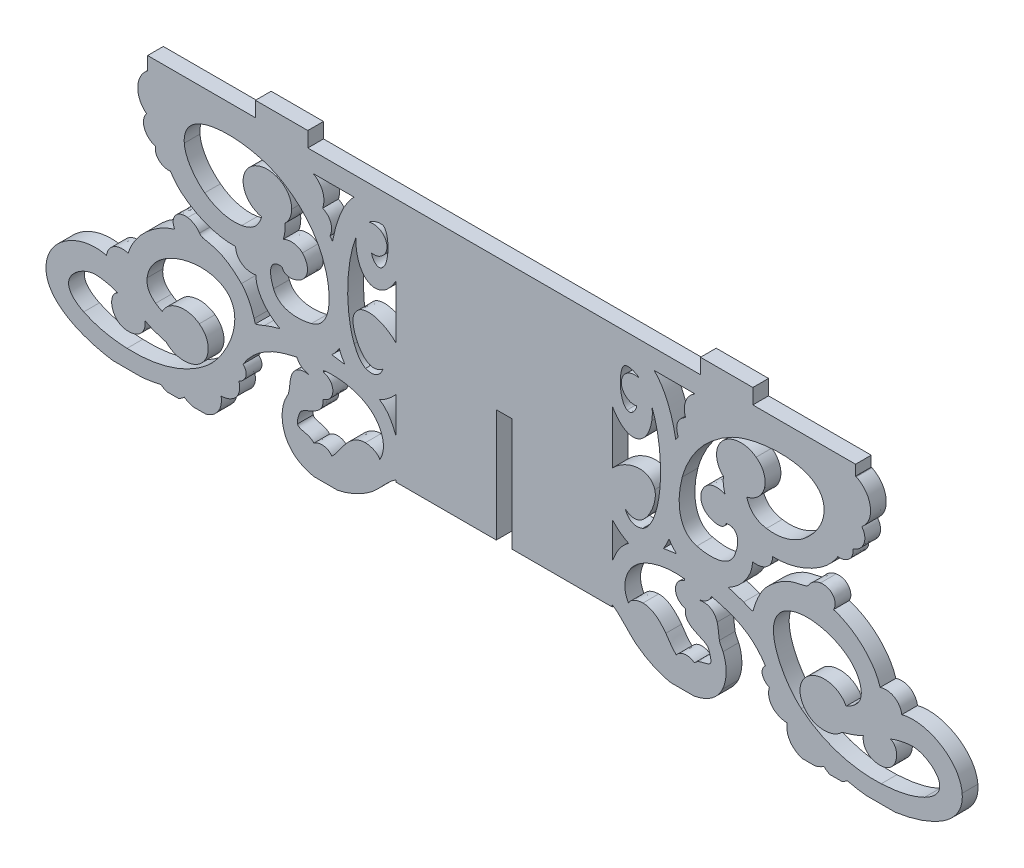
from build123d import *

# Parameters (mm, degrees)
RESSALTO_EXTRUS_O1_DEPTH = 2


with BuildPart() as part:
    # Model → Ressalto-extrusão1 (new body)
    with BuildSketch(Plane.XY):
        with BuildLine():
            Line((-5.6284, -71.1175), (-5.6464, -70.8746))
            add(Edge.make_bspline(
                [(-5.6464, -70.8746), (-6.5419, -71.3588), (-7.8893, -73.0536), (-8.6517, -73.6479)],
                knots=[0.00990099, 0.00990099, 0.00990099, 0.00990099, 0.01980198, 0.01980198, 0.01980198, 0.01980198], degree=3))
            add(Edge.make_bspline(
                [(-8.6517, -73.6479), (-9.9492, -74.6594), (-11.4791, -75.4122), (-13.1021, -75.7285)],
                knots=[0.01980198, 0.01980198, 0.01980198, 0.01980198, 0.02970297, 0.02970297, 0.02970297, 0.02970297], degree=3))
            Line((-13.1021, -75.7285), (-16.0542, -75.7291))
            add(Edge.make_bspline(
                [(-16.0542, -75.7291), (-17.6074, -75.4426), (-18.9753, -74.6493), (-19.6727, -73.1749)],
                knots=[0.03960396, 0.03960396, 0.03960396, 0.03960396, 0.04950495, 0.04950495, 0.04950495, 0.04950495], degree=3))
            add(Edge.make_bspline(
                [(-19.6727, -73.1749), (-20.2748, -71.9018), (-20.309, -70.2987), (-19.7445, -68.9995)],
                knots=[0.04950495, 0.04950495, 0.04950495, 0.04950495, 0.059405941, 0.059405941, 0.059405941, 0.059405941], degree=3))
            add(Edge.make_bspline(
                [(-19.7445, -68.9995), (-19.5924, -68.6493), (-19.3699, -68.3546), (-19.2888, -67.9672)],
                knots=[0.059405941, 0.059405941, 0.059405941, 0.059405941, 0.069306931, 0.069306931, 0.069306931, 0.069306931], degree=3))
            add(Edge.make_bspline(
                [(-19.2888, -67.9672), (-19.1614, -67.3578), (-19.1819, -66.7034), (-18.999, -66.1037)],
                knots=[0.069306931, 0.069306931, 0.069306931, 0.069306931, 0.079207921, 0.079207921, 0.079207921, 0.079207921], degree=3))
            add(Edge.make_bspline(
                [(-18.999, -66.1037), (-18.6689, -65.0219), (-17.8333, -64.6183), (-16.8102, -64.8106)],
                knots=[0.079207921, 0.079207921, 0.079207921, 0.079207921, 0.089108911, 0.089108911, 0.089108911, 0.089108911], degree=3))
            add(Edge.make_bspline(
                [(-16.8102, -64.8106), (-16.8066, -64.7918), (-16.8024, -64.7729), (-16.7979, -64.7539)],
                knots=[0.089108911, 0.089108911, 0.089108911, 0.089108911, 0.099009901, 0.099009901, 0.099009901, 0.099009901], degree=3))
            add(Edge.make_bspline(
                [(-16.7979, -64.7539), (-17.4996, -64.6554), (-17.9964, -64.2686), (-18.281, -63.636)],
                knots=[0.099009901, 0.099009901, 0.099009901, 0.099009901, 0.108910891, 0.108910891, 0.108910891, 0.108910891], degree=3))
            Line((-18.281, -63.636), (-19.6289, -63.9795))
            add(Edge.make_bspline(
                [(-19.6289, -63.9795), (-21.9055, -64.5921), (-23.8126, -65.7446), (-25.137, -67.8442)],
                knots=[0.118811881, 0.118811881, 0.118811881, 0.118811881, 0.128712871, 0.128712871, 0.128712871, 0.128712871], degree=3))
            add(Edge.make_bspline(
                [(-25.137, -67.8442), (-24.3471, -68.5533), (-24.768, -69.5566), (-25.6484, -69.984)],
                knots=[0.128712871, 0.128712871, 0.128712871, 0.128712871, 0.138613861, 0.138613861, 0.138613861, 0.138613861], degree=3))
            add(Edge.make_bspline(
                [(-25.6484, -69.984), (-25.2197, -71.4939), (-26.2828, -72.6736), (-27.9206, -72.7687)],
                knots=[0.138613861, 0.138613861, 0.138613861, 0.138613861, 0.148514851, 0.148514851, 0.148514851, 0.148514851], degree=3))
            add(Edge.make_bspline(
                [(-27.9206, -72.7687), (-27.6704, -74.1792), (-28.5691, -75.382), (-29.8849, -75.7243)],
                knots=[0.148514851, 0.148514851, 0.148514851, 0.148514851, 0.158415842, 0.158415842, 0.158415842, 0.158415842], degree=3))
            Line((-29.8849, -75.7243), (-31.4771, -75.7251))
            add(Edge.make_bspline(
                [(-31.4771, -75.7251), (-31.8723, -75.6269), (-32.2526, -75.4578), (-32.6065, -75.2243)],
                knots=[0.168316832, 0.168316832, 0.168316832, 0.168316832, 0.178217822, 0.178217822, 0.178217822, 0.178217822], degree=3))
            add(Edge.make_bspline(
                [(-32.6065, -75.2243), (-32.7813, -75.3936), (-33.1597, -75.6888), (-33.3867, -75.7342)],
                knots=[0.178217822, 0.178217822, 0.178217822, 0.178217822, 0.188118812, 0.188118812, 0.188118812, 0.188118812], degree=3))
            Line((-33.3867, -75.7342), (-34.8157, -75.7342))
            add(Edge.make_bspline(
                [(-34.8157, -75.7342), (-35.0116, -75.6974), (-35.4128, -75.4422), (-35.5882, -75.3144)],
                knots=[0.198019802, 0.198019802, 0.198019802, 0.198019802, 0.207920792, 0.207920792, 0.207920792, 0.207920792], degree=3))
            add(Edge.make_bspline(
                [(-35.5882, -75.3144), (-36.1338, -75.4582), (-37.442, -75.702), (-37.9546, -75.7342)],
                knots=[0.207920792, 0.207920792, 0.207920792, 0.207920792, 0.217821782, 0.217821782, 0.217821782, 0.217821782], degree=3))
            Line((-37.9546, -75.7342), (-41.6837, -75.7314))
            add(Edge.make_bspline(
                [(-41.6837, -75.7314), (-44.9016, -75.2916), (-50.559, -73.5038), (-50.1979, -69.3793)],
                knots=[0.227722772, 0.227722772, 0.227722772, 0.227722772, 0.237623762, 0.237623762, 0.237623762, 0.237623762], degree=3))
            add(Edge.make_bspline(
                [(-50.1979, -69.3793), (-49.9051, -66.0319), (-45.7279, -63.6924), (-42.5097, -64.5533)],
                knots=[0.237623762, 0.237623762, 0.237623762, 0.237623762, 0.247524752, 0.247524752, 0.247524752, 0.247524752], degree=3))
            add(Edge.make_bspline(
                [(-42.5097, -64.5533), (-42.3406, -63.309), (-41.1513, -62.4945), (-39.7553, -62.9251)],
                knots=[0.247524752, 0.247524752, 0.247524752, 0.247524752, 0.257425743, 0.257425743, 0.257425743, 0.257425743], degree=3))
            add(Edge.make_bspline(
                [(-39.7553, -62.9251), (-38.9652, -60.3066), (-36.3648, -58.0655), (-33.825, -57.3134)],
                knots=[0.257425743, 0.257425743, 0.257425743, 0.257425743, 0.267326733, 0.267326733, 0.267326733, 0.267326733], degree=3))
            add(Edge.make_bspline(
                [(-33.825, -57.3134), (-34.4145, -56.2855), (-33.6513, -54.9988), (-32.1639, -55.1959)],
                knots=[0.267326733, 0.267326733, 0.267326733, 0.267326733, 0.277227723, 0.277227723, 0.277227723, 0.277227723], degree=3))
            add(Edge.make_bspline(
                [(-32.1639, -55.1959), (-31.6489, -55.2641), (-30.977, -55.6469), (-30.6727, -56.1655)],
                knots=[0.277227723, 0.277227723, 0.277227723, 0.277227723, 0.287128713, 0.287128713, 0.287128713, 0.287128713], degree=3))
            add(Edge.make_bspline(
                [(-30.6727, -56.1655), (-30.2008, -56.97), (-28.3124, -56.0095), (-25.3267, -59.0606)],
                knots=[0.287128713, 0.287128713, 0.287128713, 0.287128713, 0.297029703, 0.297029703, 0.297029703, 0.297029703], degree=3))
            add(Edge.make_bspline(
                [(-25.3267, -59.0606), (-24.602, -59.801), (-24.0346, -61.0226), (-23.718, -62.0965)],
                knots=[0.297029703, 0.297029703, 0.297029703, 0.297029703, 0.306930693, 0.306930693, 0.306930693, 0.306930693], degree=3))
            add(Edge.make_bspline(
                [(-23.718, -62.0965), (-23.6918, -62.1858), (-23.611, -62.5128), (-23.5594, -62.6316)],
                knots=[0.306930693, 0.306930693, 0.306930693, 0.306930693, 0.316831683, 0.316831683, 0.316831683, 0.316831683], degree=3))
            add(Edge.make_bspline(
                [(-23.5594, -62.6316), (-23.2891, -62.5994), (-22.6447, -62.3095), (-22.3768, -62.2085)],
                knots=[0.316831683, 0.316831683, 0.316831683, 0.316831683, 0.326732673, 0.326732673, 0.326732673, 0.326732673], degree=3))
            add(Edge.make_bspline(
                [(-22.3768, -62.2085), (-21.7257, -61.9633), (-21.0761, -61.7478), (-20.4179, -61.5711)],
                knots=[0.326732673, 0.326732673, 0.326732673, 0.326732673, 0.336633663, 0.336633663, 0.336633663, 0.336633663], degree=3))
            add(Edge.make_bspline(
                [(-20.4179, -61.5711), (-22.012, -60.7087), (-23.4449, -59.0724), (-23.5064, -57.1855)],
                knots=[0.336633663, 0.336633663, 0.336633663, 0.336633663, 0.346534653, 0.346534653, 0.346534653, 0.346534653], degree=3))
            add(Edge.make_bspline(
                [(-23.5064, -57.1855), (-24.7892, -57.4359), (-26.0243, -56.7031), (-26.0724, -55.3434)],
                knots=[0.346534653, 0.346534653, 0.346534653, 0.346534653, 0.356435644, 0.356435644, 0.356435644, 0.356435644], degree=3))
            add(Edge.make_bspline(
                [(-26.0724, -55.3434), (-28.4957, -55.44), (-31.1466, -54.4236), (-32.9791, -52.8434)],
                knots=[0.356435644, 0.356435644, 0.356435644, 0.356435644, 0.366336634, 0.366336634, 0.366336634, 0.366336634], degree=3))
            add(Edge.make_bspline(
                [(-32.9791, -52.8434), (-33.492, -52.401), (-33.9776, -51.8123), (-34.3711, -51.1973)],
                knots=[0.366336634, 0.366336634, 0.366336634, 0.366336634, 0.376237624, 0.376237624, 0.376237624, 0.376237624], degree=3))
            add(Edge.make_bspline(
                [(-34.3711, -51.1973), (-35.3634, -51.3239), (-36.4953, -50.5348), (-36.2723, -49.4)],
                knots=[0.376237624, 0.376237624, 0.376237624, 0.376237624, 0.386138614, 0.386138614, 0.386138614, 0.386138614], degree=3))
            add(Edge.make_bspline(
                [(-36.2723, -49.4), (-37.635, -48.9585), (-38.2812, -47.4627), (-37.4127, -46.3692)],
                knots=[0.386138614, 0.386138614, 0.386138614, 0.386138614, 0.396039604, 0.396039604, 0.396039604, 0.396039604], degree=3))
            add(Edge.make_bspline(
                [(-37.4127, -46.3692), (-39.0338, -45.0675), (-38.818, -42.7399), (-37.2753, -41.5713)],
                knots=[0.396039604, 0.396039604, 0.396039604, 0.396039604, 0.405940594, 0.405940594, 0.405940594, 0.405940594], degree=3))
            Line((-37.2753, -41.5713), (-37.2753, -39.8829))
            Line((-37.2753, -39.8829), (-23.5478, -39.8829))
            Line((-23.5478, -39.8829), (-23.5478, -37.9569))
            Line((-23.5478, -37.9569), (-16.8811, -37.9569))
            Line((-16.8811, -37.9569), (-16.8811, -39.8829))
            add(Edge.make_bspline(
                [(-16.8811, -39.8829), (24.2554, -39.8829), (-8.0177, -39.8829), (33.1189, -39.8829)],
                knots=[0.455445545, 0.455445545, 0.455445545, 0.455445545, 0.465346535, 0.465346535, 0.465346535, 0.465346535], degree=3))
            Line((33.1189, -39.8829), (33.1189, -37.9569))
            Line((33.1189, -37.9569), (39.7856, -37.9569))
            Line((39.7856, -37.9569), (39.7856, -39.8829))
            Line((39.7856, -39.8829), (52.8602, -39.8829))
            Line((52.8602, -39.8829), (52.8602, -41.2009))
            Line((52.8602, -41.2009), (52.8959, -41.2009))
            Line((52.8959, -41.2009), (52.9623, -41.2332))
            add(Edge.make_bspline(
                [(52.9623, -41.2332), (54.9872, -42.2202), (55.4482, -44.9256), (53.6504, -46.3692)],
                knots=[0.534653465, 0.534653465, 0.534653465, 0.534653465, 0.544554455, 0.544554455, 0.544554455, 0.544554455], degree=3))
            add(Edge.make_bspline(
                [(53.6504, -46.3692), (54.519, -47.4627), (53.8727, -48.9585), (52.5101, -49.4)],
                knots=[0.544554455, 0.544554455, 0.544554455, 0.544554455, 0.554455446, 0.554455446, 0.554455446, 0.554455446], degree=3))
            add(Edge.make_bspline(
                [(52.5101, -49.4), (52.733, -50.5348), (51.6012, -51.3239), (50.6088, -51.1973)],
                knots=[0.554455446, 0.554455446, 0.554455446, 0.554455446, 0.564356436, 0.564356436, 0.564356436, 0.564356436], degree=3))
            add(Edge.make_bspline(
                [(50.6088, -51.1973), (50.2153, -51.8123), (49.7298, -52.401), (49.2168, -52.8434)],
                knots=[0.564356436, 0.564356436, 0.564356436, 0.564356436, 0.574257426, 0.574257426, 0.574257426, 0.574257426], degree=3))
            add(Edge.make_bspline(
                [(49.2168, -52.8434), (47.3843, -54.4236), (44.7334, -55.44), (42.3101, -55.3434)],
                knots=[0.574257426, 0.574257426, 0.574257426, 0.574257426, 0.584158416, 0.584158416, 0.584158416, 0.584158416], degree=3))
            add(Edge.make_bspline(
                [(42.3101, -55.3434), (42.262, -56.7031), (41.027, -57.4359), (39.7442, -57.1855)],
                knots=[0.584158416, 0.584158416, 0.584158416, 0.584158416, 0.594059406, 0.594059406, 0.594059406, 0.594059406], degree=3))
            add(Edge.make_bspline(
                [(39.7442, -57.1855), (39.6827, -59.0724), (38.2497, -60.7087), (36.6556, -61.5711)],
                knots=[0.594059406, 0.594059406, 0.594059406, 0.594059406, 0.603960396, 0.603960396, 0.603960396, 0.603960396], degree=3))
            add(Edge.make_bspline(
                [(36.6556, -61.5711), (37.3138, -61.7478), (37.9634, -61.9633), (38.6145, -62.2085)],
                knots=[0.603960396, 0.603960396, 0.603960396, 0.603960396, 0.613861386, 0.613861386, 0.613861386, 0.613861386], degree=3))
            add(Edge.make_bspline(
                [(38.6145, -62.2085), (38.8825, -62.3095), (39.5268, -62.5994), (39.7971, -62.6316)],
                knots=[0.613861386, 0.613861386, 0.613861386, 0.613861386, 0.623762376, 0.623762376, 0.623762376, 0.623762376], degree=3))
            add(Edge.make_bspline(
                [(39.7971, -62.6316), (39.8487, -62.5128), (39.9295, -62.1858), (39.9557, -62.0965)],
                knots=[0.623762376, 0.623762376, 0.623762376, 0.623762376, 0.633663366, 0.633663366, 0.633663366, 0.633663366], degree=3))
            add(Edge.make_bspline(
                [(39.9557, -62.0965), (40.2723, -61.0226), (40.8398, -59.801), (41.5644, -59.0606)],
                knots=[0.633663366, 0.633663366, 0.633663366, 0.633663366, 0.643564356, 0.643564356, 0.643564356, 0.643564356], degree=3))
            add(Edge.make_bspline(
                [(41.5644, -59.0606), (44.5501, -56.0095), (46.4385, -56.97), (46.9105, -56.1655)],
                knots=[0.643564356, 0.643564356, 0.643564356, 0.643564356, 0.653465347, 0.653465347, 0.653465347, 0.653465347], degree=3))
            add(Edge.make_bspline(
                [(46.9105, -56.1655), (47.2147, -55.6469), (47.8867, -55.2641), (48.4016, -55.1959)],
                knots=[0.653465347, 0.653465347, 0.653465347, 0.653465347, 0.663366337, 0.663366337, 0.663366337, 0.663366337], degree=3))
            add(Edge.make_bspline(
                [(48.4016, -55.1959), (49.8891, -54.9988), (50.6522, -56.2855), (50.0628, -57.3134)],
                knots=[0.663366337, 0.663366337, 0.663366337, 0.663366337, 0.673267327, 0.673267327, 0.673267327, 0.673267327], degree=3))
            add(Edge.make_bspline(
                [(50.0628, -57.3134), (52.6026, -58.0655), (55.2029, -60.3066), (55.9931, -62.9251)],
                knots=[0.673267327, 0.673267327, 0.673267327, 0.673267327, 0.683168317, 0.683168317, 0.683168317, 0.683168317], degree=3))
            add(Edge.make_bspline(
                [(55.9931, -62.9251), (57.389, -62.4945), (58.5783, -63.309), (58.7475, -64.5533)],
                knots=[0.683168317, 0.683168317, 0.683168317, 0.683168317, 0.693069307, 0.693069307, 0.693069307, 0.693069307], degree=3))
            add(Edge.make_bspline(
                [(58.7475, -64.5533), (61.9656, -63.6924), (66.1428, -66.0319), (66.4357, -69.3793)],
                knots=[0.693069307, 0.693069307, 0.693069307, 0.693069307, 0.702970297, 0.702970297, 0.702970297, 0.702970297], degree=3))
            add(Edge.make_bspline(
                [(66.4357, -69.3793), (66.7967, -73.5038), (61.1393, -75.2916), (57.9215, -75.7314)],
                knots=[0.702970297, 0.702970297, 0.702970297, 0.702970297, 0.712871287, 0.712871287, 0.712871287, 0.712871287], degree=3))
            Line((57.9215, -75.7314), (54.1924, -75.7342))
            add(Edge.make_bspline(
                [(54.1924, -75.7342), (53.6797, -75.702), (52.3716, -75.4582), (51.826, -75.3144)],
                knots=[0.722772277, 0.722772277, 0.722772277, 0.722772277, 0.732673267, 0.732673267, 0.732673267, 0.732673267], degree=3))
            add(Edge.make_bspline(
                [(51.826, -75.3144), (51.6505, -75.4422), (51.2493, -75.6974), (51.0535, -75.7342)],
                knots=[0.732673267, 0.732673267, 0.732673267, 0.732673267, 0.742574257, 0.742574257, 0.742574257, 0.742574257], degree=3))
            Line((51.0535, -75.7342), (49.6245, -75.7342))
            add(Edge.make_bspline(
                [(49.6245, -75.7342), (49.3974, -75.6888), (49.019, -75.3936), (48.8442, -75.2243)],
                knots=[0.752475248, 0.752475248, 0.752475248, 0.752475248, 0.762376238, 0.762376238, 0.762376238, 0.762376238], degree=3))
            add(Edge.make_bspline(
                [(48.8442, -75.2243), (48.4903, -75.4578), (48.11, -75.6269), (47.7148, -75.7251)],
                knots=[0.762376238, 0.762376238, 0.762376238, 0.762376238, 0.772277228, 0.772277228, 0.772277228, 0.772277228], degree=3))
            Line((47.7148, -75.7251), (46.1226, -75.7243))
            add(Edge.make_bspline(
                [(46.1226, -75.7243), (44.8069, -75.382), (43.9081, -74.1792), (44.1584, -72.7687)],
                knots=[0.782178218, 0.782178218, 0.782178218, 0.782178218, 0.792079208, 0.792079208, 0.792079208, 0.792079208], degree=3))
            add(Edge.make_bspline(
                [(44.1584, -72.7687), (42.5205, -72.6736), (41.4574, -71.4939), (41.8862, -69.984)],
                knots=[0.792079208, 0.792079208, 0.792079208, 0.792079208, 0.801980198, 0.801980198, 0.801980198, 0.801980198], degree=3))
            add(Edge.make_bspline(
                [(41.8862, -69.984), (41.0057, -69.5566), (40.5849, -68.5533), (41.3748, -67.8442)],
                knots=[0.801980198, 0.801980198, 0.801980198, 0.801980198, 0.811881188, 0.811881188, 0.811881188, 0.811881188], degree=3))
            add(Edge.make_bspline(
                [(41.3748, -67.8442), (40.0503, -65.7446), (38.1433, -64.5921), (35.8666, -63.9795)],
                knots=[0.811881188, 0.811881188, 0.811881188, 0.811881188, 0.821782178, 0.821782178, 0.821782178, 0.821782178], degree=3))
            Line((35.8666, -63.9795), (34.5187, -63.636))
            add(Edge.make_bspline(
                [(34.5187, -63.636), (34.2342, -64.2686), (33.7373, -64.6554), (33.0357, -64.7539)],
                knots=[0.831683168, 0.831683168, 0.831683168, 0.831683168, 0.841584158, 0.841584158, 0.841584158, 0.841584158], degree=3))
            add(Edge.make_bspline(
                [(33.0357, -64.7539), (33.0401, -64.7729), (33.0443, -64.7918), (33.048, -64.8106)],
                knots=[0.841584158, 0.841584158, 0.841584158, 0.841584158, 0.851485149, 0.851485149, 0.851485149, 0.851485149], degree=3))
            add(Edge.make_bspline(
                [(33.048, -64.8106), (34.071, -64.6183), (34.9066, -65.0219), (35.2367, -66.1037)],
                knots=[0.851485149, 0.851485149, 0.851485149, 0.851485149, 0.861386139, 0.861386139, 0.861386139, 0.861386139], degree=3))
            add(Edge.make_bspline(
                [(35.2367, -66.1037), (35.4196, -66.7034), (35.3992, -67.3578), (35.5266, -67.9672)],
                knots=[0.861386139, 0.861386139, 0.861386139, 0.861386139, 0.871287129, 0.871287129, 0.871287129, 0.871287129], degree=3))
            add(Edge.make_bspline(
                [(35.5266, -67.9672), (35.6076, -68.3546), (35.8302, -68.6493), (35.9823, -68.9995)],
                knots=[0.871287129, 0.871287129, 0.871287129, 0.871287129, 0.881188119, 0.881188119, 0.881188119, 0.881188119], degree=3))
            add(Edge.make_bspline(
                [(35.9823, -68.9995), (36.5467, -70.2987), (36.5126, -71.9018), (35.9104, -73.1749)],
                knots=[0.881188119, 0.881188119, 0.881188119, 0.881188119, 0.891089109, 0.891089109, 0.891089109, 0.891089109], degree=3))
            add(Edge.make_bspline(
                [(35.9104, -73.1749), (35.2131, -74.6493), (33.8452, -75.4426), (32.2919, -75.7291)],
                knots=[0.891089109, 0.891089109, 0.891089109, 0.891089109, 0.900990099, 0.900990099, 0.900990099, 0.900990099], degree=3))
            Line((32.2919, -75.7291), (29.3398, -75.7285))
            add(Edge.make_bspline(
                [(29.3398, -75.7285), (27.7168, -75.4122), (26.1869, -74.6594), (24.8894, -73.6479)],
                knots=[0.910891089, 0.910891089, 0.910891089, 0.910891089, 0.920792079, 0.920792079, 0.920792079, 0.920792079], degree=3))
            add(Edge.make_bspline(
                [(24.8894, -73.6479), (24.127, -73.0536), (22.7796, -71.3588), (21.8841, -70.8746)],
                knots=[0.920792079, 0.920792079, 0.920792079, 0.920792079, 0.930693069, 0.930693069, 0.930693069, 0.930693069], degree=3))
            Line((21.8841, -70.8746), (21.8661, -71.1175))
            Line((21.8661, -71.1175), (9.1189, -71.1175))
            Line((9.1189, -71.1175), (9.1189, -56.74))
            Line((9.1189, -56.74), (7.1189, -56.74))
            Line((7.1189, -56.74), (7.1189, -71.1175))
            Line((7.1189, -71.1175), (-5.6284, -71.1175))
        make_face()
        with BuildLine():
            Line((-10.9876, -42.3523), (-16.2025, -42.3523))
            add(Edge.make_bspline(
                [(-16.2025, -42.3523), (-15.1507, -42.9311), (-14.5218, -44.1493), (-14.9827, -45.5708)],
                knots=[0, 0, 0, 0, 0.166666667, 0.166666667, 0.166666667, 0.166666667], degree=3))
            add(Edge.make_bspline(
                [(-14.9827, -45.5708), (-13.9248, -46.0819), (-13.6065, -47.078), (-14.0462, -48.1542)],
                knots=[0.166666667, 0.166666667, 0.166666667, 0.166666667, 0.333333333, 0.333333333, 0.333333333, 0.333333333], degree=3))
            add(Edge.make_bspline(
                [(-14.0462, -48.1542), (-13.9394, -48.3036), (-13.8344, -48.4621), (-13.7323, -48.6243)],
                knots=[0.333333333, 0.333333333, 0.333333333, 0.333333333, 0.5, 0.5, 0.5, 0.5], degree=3))
            add(Edge.make_bspline(
                [(-13.7323, -48.6243), (-13.3251, -46.2966), (-12.4877, -43.8395), (-10.9876, -42.3523)],
                knots=[0.5, 0.5, 0.5, 0.5, 0.666666667, 0.666666667, 0.666666667, 0.666666667], degree=3))
        make_face(mode=Mode.SUBTRACT)
        with BuildLine():
            Line((32.4403, -42.3523), (27.2253, -42.3523))
            add(Edge.make_bspline(
                [(27.2253, -42.3523), (28.7254, -43.8395), (29.5629, -46.2966), (29.97, -48.6243)],
                knots=[0, 0, 0, 0, 0.166666667, 0.166666667, 0.166666667, 0.166666667], degree=3))
            add(Edge.make_bspline(
                [(29.97, -48.6243), (30.0721, -48.4621), (30.1772, -48.3036), (30.2839, -48.1542)],
                knots=[0.166666667, 0.166666667, 0.166666667, 0.166666667, 0.333333333, 0.333333333, 0.333333333, 0.333333333], degree=3))
            add(Edge.make_bspline(
                [(30.2839, -48.1542), (29.8442, -47.078), (30.1626, -46.0819), (31.2204, -45.5708)],
                knots=[0.333333333, 0.333333333, 0.333333333, 0.333333333, 0.5, 0.5, 0.5, 0.5], degree=3))
            add(Edge.make_bspline(
                [(31.2204, -45.5708), (30.7596, -44.1493), (31.3885, -42.9311), (32.4403, -42.3523)],
                knots=[0.5, 0.5, 0.5, 0.5, 0.666666667, 0.666666667, 0.666666667, 0.666666667], degree=3))
        make_face(mode=Mode.SUBTRACT)
        with BuildLine():
            Line((21.8983, -65.9918), (21.8983, -61.4665))
            add(Edge.make_bspline(
                [(21.8983, -61.4665), (22.4767, -62.1138), (23.2107, -62.7157), (23.9781, -63.0524)],
                knots=[0.25, 0.25, 0.25, 0.25, 0.5, 0.5, 0.5, 0.5], degree=3))
            add(Edge.make_bspline(
                [(23.9781, -63.0524), (22.8318, -63.8652), (22.4114, -64.7538), (21.8983, -65.9918)],
                knots=[0.5, 0.5, 0.5, 0.5, 1, 1, 1, 1], degree=3))
        make_face(mode=Mode.SUBTRACT)
        with BuildLine():
            Line((21.8983, -55.7779), (21.8983, -48.9534))
            add(Edge.make_bspline(
                [(21.8983, -48.9534), (23.715, -52.2071), (26.3849, -51.5086), (26.9173, -48.0577)],
                knots=[0.363636364, 0.363636364, 0.363636364, 0.363636364, 0.454545455, 0.454545455, 0.454545455, 0.454545455], degree=3))
            add(Edge.make_bspline(
                [(26.9173, -48.0577), (26.9939, -47.5614), (27.0085, -47.0558), (26.9564, -46.579)],
                knots=[0.454545455, 0.454545455, 0.454545455, 0.454545455, 0.545454545, 0.545454545, 0.545454545, 0.545454545], degree=3))
            add(Edge.make_bspline(
                [(26.9564, -46.579), (28.2487, -49.8227), (28.451, -55.2831), (27.213, -58.5173)],
                knots=[0.545454545, 0.545454545, 0.545454545, 0.545454545, 0.636363636, 0.636363636, 0.636363636, 0.636363636], degree=3))
            add(Edge.make_bspline(
                [(27.213, -58.5173), (26.9098, -59.3094), (26.4428, -60.1467), (25.7631, -60.5059)],
                knots=[0.636363636, 0.636363636, 0.636363636, 0.636363636, 0.727272727, 0.727272727, 0.727272727, 0.727272727], degree=3))
            add(Edge.make_bspline(
                [(25.7631, -60.5059), (25.054, -60.7711), (24.3, -60.7374), (23.8014, -59.9858)],
                knots=[0.727272727, 0.727272727, 0.727272727, 0.727272727, 0.818181818, 0.818181818, 0.818181818, 0.818181818], degree=3))
            add(Edge.make_bspline(
                [(23.8014, -59.9858), (23.6985, -59.8307), (23.6152, -59.6568), (23.5508, -59.4726)],
                knots=[0.818181818, 0.818181818, 0.818181818, 0.818181818, 1, 1, 1, 1], degree=3))
            add(Edge.make_bspline(
                [(23.5508, -59.4726), (23.9717, -59.8538), (24.5568, -60.0203), (25.0819, -59.8898)],
                knots=[0, 0, 0, 0, 0.090909091, 0.090909091, 0.090909091, 0.090909091], degree=3))
            add(Edge.make_bspline(
                [(25.0819, -59.8898), (26.5124, -59.5344), (27.6791, -56.6553), (27.2955, -55.4657)],
                knots=[0.090909091, 0.090909091, 0.090909091, 0.090909091, 0.181818182, 0.181818182, 0.181818182, 0.181818182], degree=3))
            add(Edge.make_bspline(
                [(27.2955, -55.4657), (26.5745, -53.2297), (23.4797, -54.1031), (21.8983, -55.7779)],
                knots=[0.181818182, 0.181818182, 0.181818182, 0.181818182, 0.272727273, 0.272727273, 0.272727273, 0.272727273], degree=3))
        make_face(mode=Mode.SUBTRACT)
        with BuildLine():
            Line((30.061, -61.1551), (28.4015, -61.4015))
            add(Edge.make_bspline(
                [(28.4015, -61.4015), (28.6801, -60.9661), (28.9165, -60.4833), (29.1159, -59.9892)],
                knots=[0.25, 0.25, 0.25, 0.25, 0.5, 0.5, 0.5, 0.5], degree=3))
            add(Edge.make_bspline(
                [(29.1159, -59.9892), (29.3835, -60.4337), (29.6983, -60.8262), (30.061, -61.1551)],
                knots=[0.5, 0.5, 0.5, 0.5, 1, 1, 1, 1], degree=3))
        make_face(mode=Mode.SUBTRACT)
        with BuildLine():
            Line((-5.6605, -65.9918), (-5.6605, -61.4665))
            add(Edge.make_bspline(
                [(-5.6605, -61.4665), (-6.239, -62.1138), (-6.9729, -62.7157), (-7.7404, -63.0524)],
                knots=[0.25, 0.25, 0.25, 0.25, 0.5, 0.5, 0.5, 0.5], degree=3))
            add(Edge.make_bspline(
                [(-7.7404, -63.0524), (-6.5941, -63.8652), (-6.1737, -64.7538), (-5.6605, -65.9918)],
                knots=[0.5, 0.5, 0.5, 0.5, 1, 1, 1, 1], degree=3))
        make_face(mode=Mode.SUBTRACT)
        with BuildLine():
            Line((-5.6605, -55.7779), (-5.6605, -48.9534))
            add(Edge.make_bspline(
                [(-5.6605, -48.9534), (-7.4773, -52.2071), (-10.1472, -51.5086), (-10.6795, -48.0577)],
                knots=[0.363636364, 0.363636364, 0.363636364, 0.363636364, 0.454545455, 0.454545455, 0.454545455, 0.454545455], degree=3))
            add(Edge.make_bspline(
                [(-10.6795, -48.0577), (-10.7561, -47.5614), (-10.7708, -47.0558), (-10.7187, -46.579)],
                knots=[0.454545455, 0.454545455, 0.454545455, 0.454545455, 0.545454545, 0.545454545, 0.545454545, 0.545454545], degree=3))
            add(Edge.make_bspline(
                [(-10.7187, -46.579), (-12.011, -49.8227), (-12.2132, -55.2831), (-10.9753, -58.5173)],
                knots=[0.545454545, 0.545454545, 0.545454545, 0.545454545, 0.636363636, 0.636363636, 0.636363636, 0.636363636], degree=3))
            add(Edge.make_bspline(
                [(-10.9753, -58.5173), (-10.6721, -59.3094), (-10.205, -60.1467), (-9.5254, -60.5059)],
                knots=[0.636363636, 0.636363636, 0.636363636, 0.636363636, 0.727272727, 0.727272727, 0.727272727, 0.727272727], degree=3))
            add(Edge.make_bspline(
                [(-9.5254, -60.5059), (-8.8163, -60.7711), (-8.0623, -60.7374), (-7.5637, -59.9858)],
                knots=[0.727272727, 0.727272727, 0.727272727, 0.727272727, 0.818181818, 0.818181818, 0.818181818, 0.818181818], degree=3))
            add(Edge.make_bspline(
                [(-7.5637, -59.9858), (-7.4608, -59.8307), (-7.3775, -59.6568), (-7.3131, -59.4726)],
                knots=[0.818181818, 0.818181818, 0.818181818, 0.818181818, 1, 1, 1, 1], degree=3))
            add(Edge.make_bspline(
                [(-7.3131, -59.4726), (-7.734, -59.8538), (-8.3191, -60.0203), (-8.8441, -59.8898)],
                knots=[0, 0, 0, 0, 0.090909091, 0.090909091, 0.090909091, 0.090909091], degree=3))
            add(Edge.make_bspline(
                [(-8.8441, -59.8898), (-10.2747, -59.5344), (-11.4413, -56.6553), (-11.0577, -55.4657)],
                knots=[0.090909091, 0.090909091, 0.090909091, 0.090909091, 0.181818182, 0.181818182, 0.181818182, 0.181818182], degree=3))
            add(Edge.make_bspline(
                [(-11.0577, -55.4657), (-10.3368, -53.2297), (-7.2419, -54.1031), (-5.6605, -55.7779)],
                knots=[0.181818182, 0.181818182, 0.181818182, 0.181818182, 0.272727273, 0.272727273, 0.272727273, 0.272727273], degree=3))
        make_face(mode=Mode.SUBTRACT)
        with BuildLine():
            Line((-13.8232, -61.1551), (-12.1638, -61.4015))
            add(Edge.make_bspline(
                [(-12.1638, -61.4015), (-12.4424, -60.9661), (-12.6788, -60.4833), (-12.8781, -59.9892)],
                knots=[0.25, 0.25, 0.25, 0.25, 0.5, 0.5, 0.5, 0.5], degree=3))
            add(Edge.make_bspline(
                [(-12.8781, -59.9892), (-13.1457, -60.4337), (-13.4606, -60.8262), (-13.8232, -61.1551)],
                knots=[0.5, 0.5, 0.5, 0.5, 1, 1, 1, 1], degree=3))
        make_face(mode=Mode.SUBTRACT)
        with BuildLine():
            add(Edge.make_bspline(
                [(25.3652, -44.1753), (23.4778, -43.615), (22.2258, -45.7973), (23.6524, -47.0363)],
                knots=[0, 0, 0, 0, 0.166666667, 0.166666667, 0.166666667, 0.166666667], degree=3))
            add(Edge.make_bspline(
                [(23.6524, -47.0363), (24.0428, -47.3753), (24.532, -47.4964), (25.0001, -47.3837)],
                knots=[0.166666667, 0.166666667, 0.166666667, 0.166666667, 0.333333333, 0.333333333, 0.333333333, 0.333333333], degree=3))
            add(Edge.make_bspline(
                [(25.0001, -47.3837), (24.9505, -47.8912), (24.3805, -48.7674), (23.7771, -48.4443)],
                knots=[0.333333333, 0.333333333, 0.333333333, 0.333333333, 0.5, 0.5, 0.5, 0.5], degree=3))
            add(Edge.make_bspline(
                [(23.7771, -48.4443), (22.6078, -47.8182), (22.6642, -43.7262), (23.6446, -43.6067)],
                knots=[0.5, 0.5, 0.5, 0.5, 0.666666667, 0.666666667, 0.666666667, 0.666666667], degree=3))
            add(Edge.make_bspline(
                [(23.6446, -43.6067), (24.2518, -43.5328), (24.8926, -43.7954), (25.3652, -44.1753)],
                knots=[0.666666667, 0.666666667, 0.666666667, 0.666666667, 1, 1, 1, 1], degree=3))
        make_face(mode=Mode.SUBTRACT)
        with BuildLine():
            add(Edge.make_bspline(
                [(36.0381, -49.6439), (35.9571, -50.2985), (36.0478, -50.8902), (36.2461, -51.5103)],
                knots=[0, 0, 0, 0, 0.058823529, 0.058823529, 0.058823529, 0.058823529], degree=3))
            add(Edge.make_bspline(
                [(36.2461, -51.5103), (35.4573, -51.1422), (34.4529, -51.158), (33.8083, -51.8027)],
                knots=[0.058823529, 0.058823529, 0.058823529, 0.058823529, 0.117647059, 0.117647059, 0.117647059, 0.117647059], degree=3))
            add(Edge.make_bspline(
                [(33.8083, -51.8027), (32.824, -52.7873), (32.906, -54.4153), (34.3932, -55.0923)],
                knots=[0.117647059, 0.117647059, 0.117647059, 0.117647059, 0.176470588, 0.176470588, 0.176470588, 0.176470588], degree=3))
            add(Edge.make_bspline(
                [(34.3932, -55.0923), (35.0481, -55.3904), (36.1044, -55.5153), (36.38, -54.6548)],
                knots=[0.176470588, 0.176470588, 0.176470588, 0.176470588, 0.235294118, 0.235294118, 0.235294118, 0.235294118], degree=3))
            add(Edge.make_bspline(
                [(36.38, -54.6548), (36.7529, -54.5614), (37.1846, -54.5967), (37.4917, -54.8849)],
                knots=[0.235294118, 0.235294118, 0.235294118, 0.235294118, 0.294117647, 0.294117647, 0.294117647, 0.294117647], degree=3))
            add(Edge.make_bspline(
                [(37.4917, -54.8849), (38.1562, -55.5082), (37.7715, -56.8569), (37.4787, -57.5909)],
                knots=[0.294117647, 0.294117647, 0.294117647, 0.294117647, 0.352941176, 0.352941176, 0.352941176, 0.352941176], degree=3))
            add(Edge.make_bspline(
                [(37.4787, -57.5909), (36.7026, -59.5363), (34.098, -59.3942), (32.653, -59.0123)],
                knots=[0.352941176, 0.352941176, 0.352941176, 0.352941176, 0.411764706, 0.411764706, 0.411764706, 0.411764706], degree=3))
            add(Edge.make_bspline(
                [(32.653, -59.0123), (29.9072, -58.2868), (30.2036, -54.4466), (30.8, -52.3237)],
                knots=[0.411764706, 0.411764706, 0.411764706, 0.411764706, 0.470588235, 0.470588235, 0.470588235, 0.470588235], degree=3))
            add(Edge.make_bspline(
                [(30.8, -52.3237), (31.8304, -48.6565), (34.2859, -46.2351), (37.1386, -44.7681)],
                knots=[0.470588235, 0.470588235, 0.470588235, 0.470588235, 0.529411765, 0.529411765, 0.529411765, 0.529411765], degree=3))
            add(Edge.make_bspline(
                [(37.1386, -44.7681), (40.7014, -42.9359), (49.1984, -42.4396), (48.8428, -47.2099)],
                knots=[0.529411765, 0.529411765, 0.529411765, 0.529411765, 0.588235294, 0.588235294, 0.588235294, 0.588235294], degree=3))
            add(Edge.make_bspline(
                [(48.8428, -47.2099), (48.7201, -48.8558), (47.4807, -50.4334), (46.2401, -51.3905)],
                knots=[0.588235294, 0.588235294, 0.588235294, 0.588235294, 0.647058824, 0.647058824, 0.647058824, 0.647058824], degree=3))
            add(Edge.make_bspline(
                [(46.2401, -51.3905), (44.8579, -52.4568), (43.1427, -52.9059), (41.5242, -52.6311)],
                knots=[0.647058824, 0.647058824, 0.647058824, 0.647058824, 0.705882353, 0.705882353, 0.705882353, 0.705882353], degree=3))
            add(Edge.make_bspline(
                [(41.5242, -52.6311), (40.1542, -52.3985), (39.3691, -51.6872), (39.004, -50.424)],
                knots=[0.705882353, 0.705882353, 0.705882353, 0.705882353, 0.764705882, 0.764705882, 0.764705882, 0.764705882], degree=3))
            add(Edge.make_bspline(
                [(39.004, -50.424), (41.467, -49.8517), (42.2002, -46.9164), (40.2066, -45.4338)],
                knots=[0.764705882, 0.764705882, 0.764705882, 0.764705882, 0.823529412, 0.823529412, 0.823529412, 0.823529412], degree=3))
            add(Edge.make_bspline(
                [(40.2066, -45.4338), (38.2649, -43.9897), (35.1699, -45.1675), (35.1699, -47.6557)],
                knots=[0.823529412, 0.823529412, 0.823529412, 0.823529412, 0.882352941, 0.882352941, 0.882352941, 0.882352941], degree=3))
            add(Edge.make_bspline(
                [(35.1699, -47.6557), (35.1699, -48.47), (35.5296, -49.1593), (36.0381, -49.6439)],
                knots=[0.882352941, 0.882352941, 0.882352941, 0.882352941, 1, 1, 1, 1], degree=3))
        make_face(mode=Mode.SUBTRACT)
        with BuildLine():
            add(Edge.make_bspline(
                [(51.1493, -70.302), (52.1053, -70.0032), (53.0002, -69.7957), (53.8539, -69.2753)],
                knots=[0, 0, 0, 0, 0.066666667, 0.066666667, 0.066666667, 0.066666667], degree=3))
            add(Edge.make_bspline(
                [(53.8539, -69.2753), (53.6479, -70.8072), (54.9122, -71.6846), (56.3066, -71.4968)],
                knots=[0.066666667, 0.066666667, 0.066666667, 0.066666667, 0.133333333, 0.133333333, 0.133333333, 0.133333333], degree=3))
            add(Edge.make_bspline(
                [(56.3066, -71.4968), (58.3124, -71.2268), (58.6016, -68.4463), (57.3006, -67.9677)],
                knots=[0.133333333, 0.133333333, 0.133333333, 0.133333333, 0.2, 0.2, 0.2, 0.2], degree=3))
            add(Edge.make_bspline(
                [(57.3006, -67.9677), (58.0363, -67.628), (59.5416, -67.2987), (60.365, -67.3633)],
                knots=[0.2, 0.2, 0.2, 0.2, 0.266666667, 0.266666667, 0.266666667, 0.266666667], degree=3))
            add(Edge.make_bspline(
                [(60.365, -67.3633), (62.3074, -67.5155), (65.7576, -70.1563), (61.6432, -72.2178)],
                knots=[0.266666667, 0.266666667, 0.266666667, 0.266666667, 0.333333333, 0.333333333, 0.333333333, 0.333333333], degree=3))
            add(Edge.make_bspline(
                [(61.6432, -72.2178), (59.9784, -73.0519), (57.9677, -73.3982), (56.1294, -73.4798)],
                knots=[0.333333333, 0.333333333, 0.333333333, 0.333333333, 0.4, 0.4, 0.4, 0.4], degree=3))
            add(Edge.make_bspline(
                [(56.1294, -73.4798), (52.5719, -73.6375), (48.9495, -72.7449), (45.962, -70.2917)],
                knots=[0.4, 0.4, 0.4, 0.4, 0.466666667, 0.466666667, 0.466666667, 0.466666667], degree=3))
            add(Edge.make_bspline(
                [(45.962, -70.2917), (43.1531, -67.9854), (39.8805, -61.0969), (45.4357, -59.9631)],
                knots=[0.466666667, 0.466666667, 0.466666667, 0.466666667, 0.533333333, 0.533333333, 0.533333333, 0.533333333], degree=3))
            add(Edge.make_bspline(
                [(45.4357, -59.9631), (48.3962, -59.3589), (53.1811, -61.0898), (53.572, -64.4293)],
                knots=[0.533333333, 0.533333333, 0.533333333, 0.533333333, 0.6, 0.6, 0.6, 0.6], degree=3))
            add(Edge.make_bspline(
                [(53.572, -64.4293), (53.6908, -65.4442), (53.2531, -66.1246), (52.4812, -66.6814)],
                knots=[0.6, 0.6, 0.6, 0.6, 0.666666667, 0.666666667, 0.666666667, 0.666666667], degree=3))
            add(Edge.make_bspline(
                [(52.4812, -66.6814), (52.2802, -66.8263), (51.9406, -67.0451), (51.655, -67.1704)],
                knots=[0.666666667, 0.666666667, 0.666666667, 0.666666667, 0.733333333, 0.733333333, 0.733333333, 0.733333333], degree=3))
            add(Edge.make_bspline(
                [(51.655, -67.1704), (50.7762, -65.4229), (48.3934, -65.0916), (46.935, -66.1762)],
                knots=[0.733333333, 0.733333333, 0.733333333, 0.733333333, 0.8, 0.8, 0.8, 0.8], degree=3))
            add(Edge.make_bspline(
                [(46.935, -66.1762), (44.6881, -67.8471), (45.9755, -71.2273), (48.8706, -71.2273)],
                knots=[0.8, 0.8, 0.8, 0.8, 0.866666667, 0.866666667, 0.866666667, 0.866666667], degree=3))
            add(Edge.make_bspline(
                [(48.8706, -71.2273), (49.6737, -71.2273), (50.5239, -70.9372), (51.1493, -70.302)],
                knots=[0.866666667, 0.866666667, 0.866666667, 0.866666667, 1, 1, 1, 1], degree=3))
        make_face(mode=Mode.SUBTRACT)
        with BuildLine():
            add(Edge.make_bspline(
                [(23.9524, -69.659), (23.2017, -68.3663), (23.4088, -66.9809), (24.2064, -65.7629)],
                knots=[0, 0, 0, 0, 0.083333333, 0.083333333, 0.083333333, 0.083333333], degree=3))
            add(Edge.make_bspline(
                [(24.2064, -65.7629), (25.5334, -63.7363), (28.7512, -63.084), (31.1004, -63.4128)],
                knots=[0.083333333, 0.083333333, 0.083333333, 0.083333333, 0.166666667, 0.166666667, 0.166666667, 0.166666667], degree=3))
            add(Edge.make_bspline(
                [(31.1004, -63.4128), (31.0988, -63.4819), (31.1027, -63.5511), (31.1118, -63.6196)],
                knots=[0.166666667, 0.166666667, 0.166666667, 0.166666667, 0.25, 0.25, 0.25, 0.25], degree=3))
            add(Edge.make_bspline(
                [(31.1118, -63.6196), (29.5784, -63.9869), (29.4562, -66.1418), (31.2042, -66.6447)],
                knots=[0.25, 0.25, 0.25, 0.25, 0.333333333, 0.333333333, 0.333333333, 0.333333333], degree=3))
            add(Edge.make_bspline(
                [(31.2042, -66.6447), (30.9074, -68.6379), (33.7456, -68.7201), (34.1184, -69.5314)],
                knots=[0.333333333, 0.333333333, 0.333333333, 0.333333333, 0.416666667, 0.416666667, 0.416666667, 0.416666667], degree=3))
            add(Edge.make_bspline(
                [(34.1184, -69.5314), (34.2574, -69.8338), (34.5133, -70.6115), (34.4225, -70.9571)],
                knots=[0.416666667, 0.416666667, 0.416666667, 0.416666667, 0.5, 0.5, 0.5, 0.5], degree=3))
            add(Edge.make_bspline(
                [(34.4225, -70.9571), (34.2683, -71.5431), (32.9564, -71.2707), (32.3438, -72.0431)],
                knots=[0.5, 0.5, 0.5, 0.5, 0.583333333, 0.583333333, 0.583333333, 0.583333333], degree=3))
            add(Edge.make_bspline(
                [(32.3438, -72.0431), (31.642, -71.514), (30.5964, -71.5817), (30.045, -72.3235)],
                knots=[0.583333333, 0.583333333, 0.583333333, 0.583333333, 0.666666667, 0.666666667, 0.666666667, 0.666666667], degree=3))
            add(Edge.make_bspline(
                [(30.045, -72.3235), (29.416, -71.7429), (29.1977, -71.2589), (28.7045, -70.6024)],
                knots=[0.666666667, 0.666666667, 0.666666667, 0.666666667, 0.75, 0.75, 0.75, 0.75], degree=3))
            add(Edge.make_bspline(
                [(28.7045, -70.6024), (28.0003, -69.665), (27.0428, -68.694), (25.7952, -68.7199)],
                knots=[0.75, 0.75, 0.75, 0.75, 0.833333333, 0.833333333, 0.833333333, 0.833333333], degree=3))
            add(Edge.make_bspline(
                [(25.7952, -68.7199), (25.1347, -68.7335), (24.2483, -69.0072), (23.9524, -69.659)],
                knots=[0.833333333, 0.833333333, 0.833333333, 0.833333333, 1, 1, 1, 1], degree=3))
        make_face(mode=Mode.SUBTRACT)
        with BuildLine():
            add(Edge.make_bspline(
                [(-9.1275, -44.1753), (-7.2401, -43.615), (-5.9881, -45.7973), (-7.4147, -47.0363)],
                knots=[0, 0, 0, 0, 0.166666667, 0.166666667, 0.166666667, 0.166666667], degree=3))
            add(Edge.make_bspline(
                [(-7.4147, -47.0363), (-7.805, -47.3753), (-8.2942, -47.4964), (-8.7624, -47.3837)],
                knots=[0.166666667, 0.166666667, 0.166666667, 0.166666667, 0.333333333, 0.333333333, 0.333333333, 0.333333333], degree=3))
            add(Edge.make_bspline(
                [(-8.7624, -47.3837), (-8.7128, -47.8912), (-8.1428, -48.7674), (-7.5394, -48.4443)],
                knots=[0.333333333, 0.333333333, 0.333333333, 0.333333333, 0.5, 0.5, 0.5, 0.5], degree=3))
            add(Edge.make_bspline(
                [(-7.5394, -48.4443), (-6.3701, -47.8182), (-6.4265, -43.7262), (-7.4069, -43.6067)],
                knots=[0.5, 0.5, 0.5, 0.5, 0.666666667, 0.666666667, 0.666666667, 0.666666667], degree=3))
            add(Edge.make_bspline(
                [(-7.4069, -43.6067), (-8.014, -43.5328), (-8.6549, -43.7954), (-9.1275, -44.1753)],
                knots=[0.666666667, 0.666666667, 0.666666667, 0.666666667, 1, 1, 1, 1], degree=3))
        make_face(mode=Mode.SUBTRACT)
        with BuildLine():
            add(Edge.make_bspline(
                [(-19.8004, -49.6439), (-19.7193, -50.2985), (-19.81, -50.8902), (-20.0084, -51.5103)],
                knots=[0, 0, 0, 0, 0.058823529, 0.058823529, 0.058823529, 0.058823529], degree=3))
            add(Edge.make_bspline(
                [(-20.0084, -51.5103), (-19.2196, -51.1422), (-18.2152, -51.158), (-17.5705, -51.8027)],
                knots=[0.058823529, 0.058823529, 0.058823529, 0.058823529, 0.117647059, 0.117647059, 0.117647059, 0.117647059], degree=3))
            add(Edge.make_bspline(
                [(-17.5705, -51.8027), (-16.5862, -52.7873), (-16.6682, -54.4153), (-18.1554, -55.0923)],
                knots=[0.117647059, 0.117647059, 0.117647059, 0.117647059, 0.176470588, 0.176470588, 0.176470588, 0.176470588], degree=3))
            add(Edge.make_bspline(
                [(-18.1554, -55.0923), (-18.8104, -55.3904), (-19.8667, -55.5153), (-20.1422, -54.6548)],
                knots=[0.176470588, 0.176470588, 0.176470588, 0.176470588, 0.235294118, 0.235294118, 0.235294118, 0.235294118], degree=3))
            add(Edge.make_bspline(
                [(-20.1422, -54.6548), (-20.5152, -54.5614), (-20.9468, -54.5967), (-21.254, -54.8849)],
                knots=[0.235294118, 0.235294118, 0.235294118, 0.235294118, 0.294117647, 0.294117647, 0.294117647, 0.294117647], degree=3))
            add(Edge.make_bspline(
                [(-21.254, -54.8849), (-21.9184, -55.5082), (-21.5338, -56.8569), (-21.2409, -57.5909)],
                knots=[0.294117647, 0.294117647, 0.294117647, 0.294117647, 0.352941176, 0.352941176, 0.352941176, 0.352941176], degree=3))
            add(Edge.make_bspline(
                [(-21.2409, -57.5909), (-20.4648, -59.5363), (-17.8602, -59.3942), (-16.4152, -59.0123)],
                knots=[0.352941176, 0.352941176, 0.352941176, 0.352941176, 0.411764706, 0.411764706, 0.411764706, 0.411764706], degree=3))
            add(Edge.make_bspline(
                [(-16.4152, -59.0123), (-13.6695, -58.2868), (-13.9659, -54.4466), (-14.5623, -52.3237)],
                knots=[0.411764706, 0.411764706, 0.411764706, 0.411764706, 0.470588235, 0.470588235, 0.470588235, 0.470588235], degree=3))
            add(Edge.make_bspline(
                [(-14.5623, -52.3237), (-15.5927, -48.6565), (-18.0482, -46.2351), (-20.9008, -44.7681)],
                knots=[0.470588235, 0.470588235, 0.470588235, 0.470588235, 0.529411765, 0.529411765, 0.529411765, 0.529411765], degree=3))
            add(Edge.make_bspline(
                [(-20.9008, -44.7681), (-24.4637, -42.9359), (-32.9607, -42.4396), (-32.6051, -47.2099)],
                knots=[0.529411765, 0.529411765, 0.529411765, 0.529411765, 0.588235294, 0.588235294, 0.588235294, 0.588235294], degree=3))
            add(Edge.make_bspline(
                [(-32.6051, -47.2099), (-32.4823, -48.8558), (-31.2429, -50.4334), (-30.0023, -51.3905)],
                knots=[0.588235294, 0.588235294, 0.588235294, 0.588235294, 0.647058824, 0.647058824, 0.647058824, 0.647058824], degree=3))
            add(Edge.make_bspline(
                [(-30.0023, -51.3905), (-28.6202, -52.4568), (-26.905, -52.9059), (-25.2865, -52.6311)],
                knots=[0.647058824, 0.647058824, 0.647058824, 0.647058824, 0.705882353, 0.705882353, 0.705882353, 0.705882353], degree=3))
            add(Edge.make_bspline(
                [(-25.2865, -52.6311), (-23.9165, -52.3985), (-23.1313, -51.6872), (-22.7663, -50.424)],
                knots=[0.705882353, 0.705882353, 0.705882353, 0.705882353, 0.764705882, 0.764705882, 0.764705882, 0.764705882], degree=3))
            add(Edge.make_bspline(
                [(-22.7663, -50.424), (-25.2292, -49.8517), (-25.9624, -46.9164), (-23.9688, -45.4338)],
                knots=[0.764705882, 0.764705882, 0.764705882, 0.764705882, 0.823529412, 0.823529412, 0.823529412, 0.823529412], degree=3))
            add(Edge.make_bspline(
                [(-23.9688, -45.4338), (-22.0271, -43.9897), (-18.9321, -45.1675), (-18.9321, -47.6557)],
                knots=[0.823529412, 0.823529412, 0.823529412, 0.823529412, 0.882352941, 0.882352941, 0.882352941, 0.882352941], degree=3))
            add(Edge.make_bspline(
                [(-18.9321, -47.6557), (-18.9321, -48.47), (-19.2919, -49.1593), (-19.8004, -49.6439)],
                knots=[0.882352941, 0.882352941, 0.882352941, 0.882352941, 1, 1, 1, 1], degree=3))
        make_face(mode=Mode.SUBTRACT)
        with BuildLine():
            add(Edge.make_bspline(
                [(-34.9116, -70.302), (-35.8675, -70.0032), (-36.7624, -69.7957), (-37.6162, -69.2753)],
                knots=[0, 0, 0, 0, 0.066666667, 0.066666667, 0.066666667, 0.066666667], degree=3))
            add(Edge.make_bspline(
                [(-37.6162, -69.2753), (-37.4102, -70.8072), (-38.6744, -71.6846), (-40.0688, -71.4968)],
                knots=[0.066666667, 0.066666667, 0.066666667, 0.066666667, 0.133333333, 0.133333333, 0.133333333, 0.133333333], degree=3))
            add(Edge.make_bspline(
                [(-40.0688, -71.4968), (-42.0746, -71.2268), (-42.3638, -68.4463), (-41.0629, -67.9677)],
                knots=[0.133333333, 0.133333333, 0.133333333, 0.133333333, 0.2, 0.2, 0.2, 0.2], degree=3))
            add(Edge.make_bspline(
                [(-41.0629, -67.9677), (-41.7985, -67.628), (-43.3038, -67.2987), (-44.1273, -67.3633)],
                knots=[0.2, 0.2, 0.2, 0.2, 0.266666667, 0.266666667, 0.266666667, 0.266666667], degree=3))
            add(Edge.make_bspline(
                [(-44.1273, -67.3633), (-46.0697, -67.5155), (-49.5199, -70.1563), (-45.4055, -72.2178)],
                knots=[0.266666667, 0.266666667, 0.266666667, 0.266666667, 0.333333333, 0.333333333, 0.333333333, 0.333333333], degree=3))
            add(Edge.make_bspline(
                [(-45.4055, -72.2178), (-43.7407, -73.0519), (-41.7299, -73.3982), (-39.8917, -73.4798)],
                knots=[0.333333333, 0.333333333, 0.333333333, 0.333333333, 0.4, 0.4, 0.4, 0.4], degree=3))
            add(Edge.make_bspline(
                [(-39.8917, -73.4798), (-36.3342, -73.6375), (-32.7117, -72.7449), (-29.7243, -70.2917)],
                knots=[0.4, 0.4, 0.4, 0.4, 0.466666667, 0.466666667, 0.466666667, 0.466666667], degree=3))
            add(Edge.make_bspline(
                [(-29.7243, -70.2917), (-26.9154, -67.9854), (-23.6427, -61.0969), (-29.198, -59.9631)],
                knots=[0.466666667, 0.466666667, 0.466666667, 0.466666667, 0.533333333, 0.533333333, 0.533333333, 0.533333333], degree=3))
            add(Edge.make_bspline(
                [(-29.198, -59.9631), (-32.1585, -59.3589), (-36.9434, -61.0898), (-37.3343, -64.4293)],
                knots=[0.533333333, 0.533333333, 0.533333333, 0.533333333, 0.6, 0.6, 0.6, 0.6], degree=3))
            add(Edge.make_bspline(
                [(-37.3343, -64.4293), (-37.4531, -65.4442), (-37.0154, -66.1246), (-36.2434, -66.6814)],
                knots=[0.6, 0.6, 0.6, 0.6, 0.666666667, 0.666666667, 0.666666667, 0.666666667], degree=3))
            add(Edge.make_bspline(
                [(-36.2434, -66.6814), (-36.0425, -66.8263), (-35.7029, -67.0451), (-35.4172, -67.1704)],
                knots=[0.666666667, 0.666666667, 0.666666667, 0.666666667, 0.733333333, 0.733333333, 0.733333333, 0.733333333], degree=3))
            add(Edge.make_bspline(
                [(-35.4172, -67.1704), (-34.5385, -65.4229), (-32.1557, -65.0916), (-30.6972, -66.1762)],
                knots=[0.733333333, 0.733333333, 0.733333333, 0.733333333, 0.8, 0.8, 0.8, 0.8], degree=3))
            add(Edge.make_bspline(
                [(-30.6972, -66.1762), (-28.4504, -67.8471), (-29.7377, -71.2273), (-32.6329, -71.2273)],
                knots=[0.8, 0.8, 0.8, 0.8, 0.866666667, 0.866666667, 0.866666667, 0.866666667], degree=3))
            add(Edge.make_bspline(
                [(-32.6329, -71.2273), (-33.4359, -71.2273), (-34.2861, -70.9372), (-34.9116, -70.302)],
                knots=[0.866666667, 0.866666667, 0.866666667, 0.866666667, 1, 1, 1, 1], degree=3))
        make_face(mode=Mode.SUBTRACT)
        with BuildLine():
            add(Edge.make_bspline(
                [(-7.7147, -69.659), (-6.9639, -68.3663), (-7.1711, -66.9809), (-7.9686, -65.7629)],
                knots=[0, 0, 0, 0, 0.083333333, 0.083333333, 0.083333333, 0.083333333], degree=3))
            add(Edge.make_bspline(
                [(-7.9686, -65.7629), (-9.2957, -63.7363), (-12.5134, -63.084), (-14.8627, -63.4128)],
                knots=[0.083333333, 0.083333333, 0.083333333, 0.083333333, 0.166666667, 0.166666667, 0.166666667, 0.166666667], degree=3))
            add(Edge.make_bspline(
                [(-14.8627, -63.4128), (-14.8611, -63.4819), (-14.865, -63.5511), (-14.8741, -63.6196)],
                knots=[0.166666667, 0.166666667, 0.166666667, 0.166666667, 0.25, 0.25, 0.25, 0.25], degree=3))
            add(Edge.make_bspline(
                [(-14.8741, -63.6196), (-13.3407, -63.9869), (-13.2185, -66.1418), (-14.9665, -66.6447)],
                knots=[0.25, 0.25, 0.25, 0.25, 0.333333333, 0.333333333, 0.333333333, 0.333333333], degree=3))
            add(Edge.make_bspline(
                [(-14.9665, -66.6447), (-14.6696, -68.6379), (-17.5079, -68.7201), (-17.8806, -69.5314)],
                knots=[0.333333333, 0.333333333, 0.333333333, 0.333333333, 0.416666667, 0.416666667, 0.416666667, 0.416666667], degree=3))
            add(Edge.make_bspline(
                [(-17.8806, -69.5314), (-18.0197, -69.8338), (-18.2756, -70.6115), (-18.1847, -70.9571)],
                knots=[0.416666667, 0.416666667, 0.416666667, 0.416666667, 0.5, 0.5, 0.5, 0.5], degree=3))
            add(Edge.make_bspline(
                [(-18.1847, -70.9571), (-18.0306, -71.5431), (-16.7186, -71.2707), (-16.106, -72.0431)],
                knots=[0.5, 0.5, 0.5, 0.5, 0.583333333, 0.583333333, 0.583333333, 0.583333333], degree=3))
            add(Edge.make_bspline(
                [(-16.106, -72.0431), (-15.4043, -71.514), (-14.3587, -71.5817), (-13.8072, -72.3235)],
                knots=[0.583333333, 0.583333333, 0.583333333, 0.583333333, 0.666666667, 0.666666667, 0.666666667, 0.666666667], degree=3))
            add(Edge.make_bspline(
                [(-13.8072, -72.3235), (-13.1783, -71.7429), (-12.9599, -71.2589), (-12.4668, -70.6024)],
                knots=[0.666666667, 0.666666667, 0.666666667, 0.666666667, 0.75, 0.75, 0.75, 0.75], degree=3))
            add(Edge.make_bspline(
                [(-12.4668, -70.6024), (-11.7626, -69.665), (-10.8051, -68.694), (-9.5574, -68.7199)],
                knots=[0.75, 0.75, 0.75, 0.75, 0.833333333, 0.833333333, 0.833333333, 0.833333333], degree=3))
            add(Edge.make_bspline(
                [(-9.5574, -68.7199), (-8.897, -68.7335), (-8.0106, -69.0072), (-7.7147, -69.659)],
                knots=[0.833333333, 0.833333333, 0.833333333, 0.833333333, 1, 1, 1, 1], degree=3))
        make_face(mode=Mode.SUBTRACT)
    extrude(amount=RESSALTO_EXTRUS_O1_DEPTH)


solid = part.part
